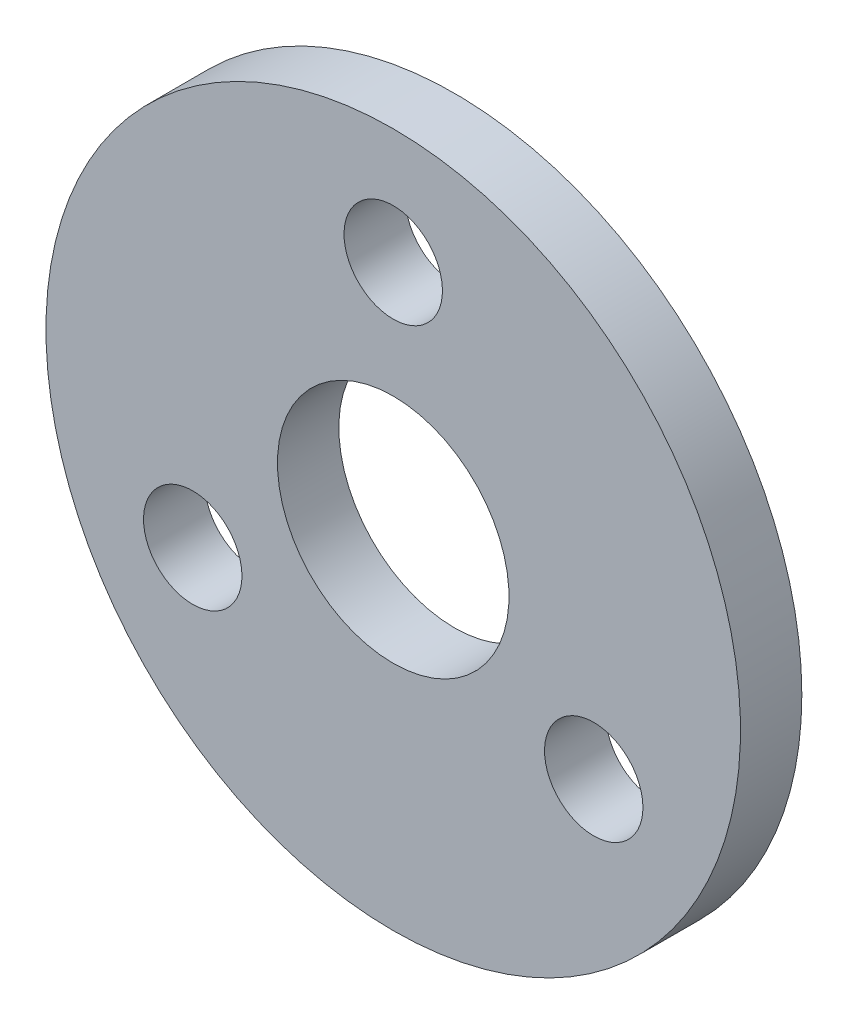
from build123d import *

# Parameters (mm, degrees)
BOSS_EXTRUDE1_START = 9.525
SKETCH1_R           = 12
SKETCH1_R_2         = 1.7
SKETCH1_R_3         = 4
BOSS_EXTRUDE1_DEPTH = 2.12


with BuildPart() as part:
    # Sketch1 → Boss-Extrude1 (new body)
    with BuildSketch(Plane.XY.offset(BOSS_EXTRUDE1_START)):
        with Locations(Location((0, 0, 0), (0, 0, 270))):
            Circle(SKETCH1_R)
        with Locations(Location((-6.92820323, -4, 0), (0, 0, 270))):
            Circle(SKETCH1_R_2, mode=Mode.SUBTRACT)
        with Locations(Location((6.92820323, -4, 0), (0, 0, 270))):
            Circle(SKETCH1_R_2, mode=Mode.SUBTRACT)
        with Locations(Location((0, 8, 0), (0, 0, 270))):
            Circle(SKETCH1_R_2, mode=Mode.SUBTRACT)
        with Locations(Location((0, 0, 0), (0, 0, 270))):
            Circle(SKETCH1_R_3, mode=Mode.SUBTRACT)
    extrude(amount=BOSS_EXTRUDE1_DEPTH)


solid = part.part
